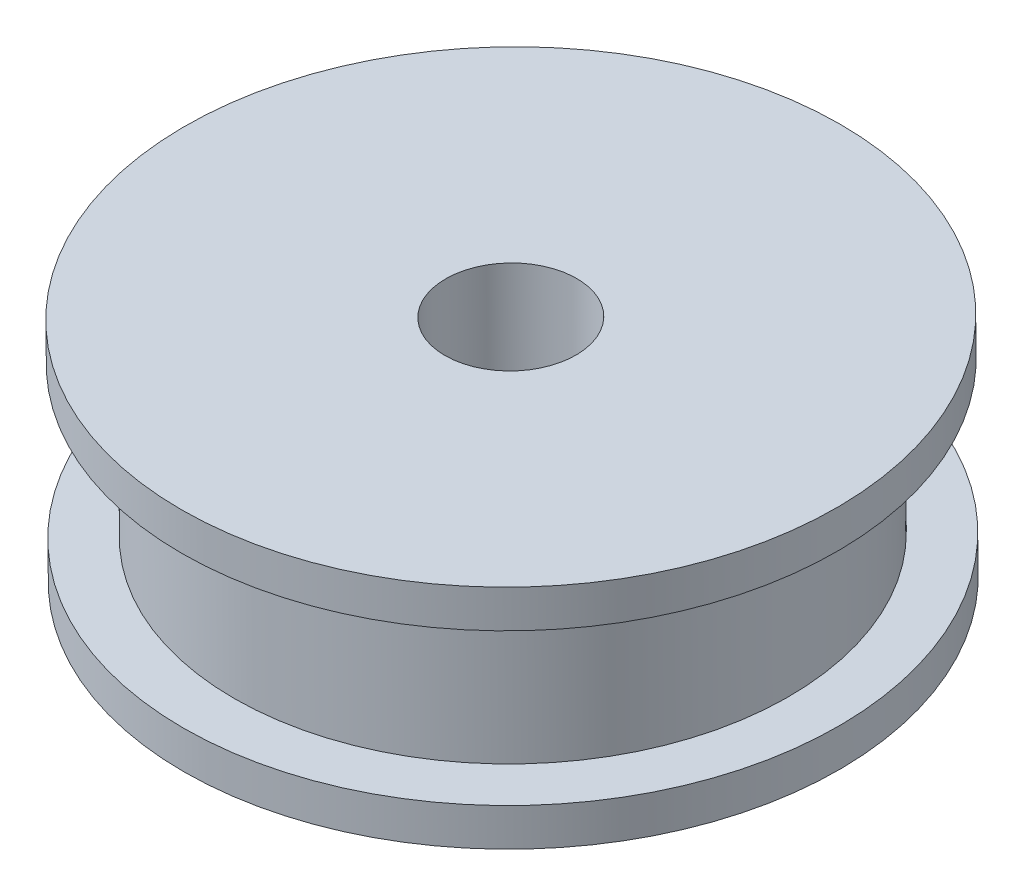
from build123d import *

# Parameters (mm, degrees)
SKETCH2_R           = 11
BOSS_EXTRUDE1_DEPTH = 6
SKETCH3_W           = 3.45
SKETCH3_H           = 3.45
CUT_EXTRUDE1_DEPTH  = 18.841034143
SKETCH4_R           = 13
BOSS_EXTRUDE2_DEPTH = 1.5
SKETCH5_W           = 3.45
SKETCH5_H           = 3.45
CUT_EXTRUDE2_DEPTH  = 22.625712586
SKETCH6_R           = 2.6
CUT_EXTRUDE3_DEPTH  = 22.625712586


with BuildPart() as part:
    # Sketch2 → Boss-Extrude1 (new body)
    with BuildSketch(Plane(origin=(-0.006046198, 2.843115255, 0.024063532), x_dir=(0.9999977389340391, 0.002126453123543878, 1.7997853821493017e-05), z_dir=(-0.00212652928721231, 0.9999619230641714, 0.008463468260412206))):
        with Locations(Location((-2.8797e-05, 1.599942694, 0), (0, 0, 270))):
            Circle(SKETCH2_R)
    extrude(amount=BOSS_EXTRUDE1_DEPTH)

    # Sketch3 → Cut-Extrude1 (cut, through all)
    with BuildSketch(Plane(origin=(-0.018805374, 8.842886793, 0.074844342), x_dir=(0.9999977389340391, 0.002126453123543878, 1.7997853821493024e-05), z_dir=(-0.00212652928721231, 0.9999619230641714, 0.00846346826041221))):
        with Locations((-2.8797e-05, 1.599942694)):
            Rectangle(SKETCH3_W, SKETCH3_H)
    extrude(amount=-CUT_EXTRUDE1_DEPTH, mode=Mode.SUBTRACT)

    # Sketch4 → Boss-Extrude2 (add)
    with BuildSketch(Plane(origin=(-0.018805374, 8.842886793, 0.074844342), x_dir=(0.9999977389340391, 0.002126453123543878, 1.7997853821493024e-05), z_dir=(-0.00212652928721231, 0.9999619230641714, 0.00846346826041221))):
        with Locations(Location((-2.8797e-05, 1.599942694, 0), (0, 0, 270))):
            Circle(SKETCH4_R)
    boss_extrude2 = extrude(amount=BOSS_EXTRUDE2_DEPTH)

    # Mirror1: Boss-Extrude2 across plane
    add(boss_extrude2.mirror(Plane(origin=(-0.012425786, 5.843001024, 0.049453937), x_dir=(1.79984577561216e-05, -0.008463449122581367, 0.9999641842111171), z_dir=(0.00212652928721231, -0.9999619230641714, -0.00846346826041221))))

    # Sketch5 → Cut-Extrude2 (cut, through all)
    with BuildSketch(Plane(origin=(-0.021995168, 10.342829678, 0.087539544), x_dir=(0.9999977389340391, 0.002126453123543878, 1.799785382149303e-05), z_dir=(-0.00212652928721231, 0.9999619230641714, 0.008463468260412213))):
        with Locations((-2.8797e-05, 1.599942694)):
            Rectangle(SKETCH5_W, SKETCH5_H)
    extrude(amount=-CUT_EXTRUDE2_DEPTH, mode=Mode.SUBTRACT)

    # Sketch6 → Cut-Extrude3 (cut, through all)
    with BuildSketch(Plane(origin=(-0.021995168, 10.342829678, 0.087539544), x_dir=(0.9999977389340391, 0.002126453123543878, 1.799785382149303e-05), z_dir=(-0.00212652928721231, 0.9999619230641714, 0.008463468260412213))):
        with Locations(Location((-2.8797e-05, 1.599942694, 0), (0, 0, 270))):
            Circle(SKETCH6_R)
    extrude(amount=-CUT_EXTRUDE3_DEPTH, mode=Mode.SUBTRACT)


solid = part.part
